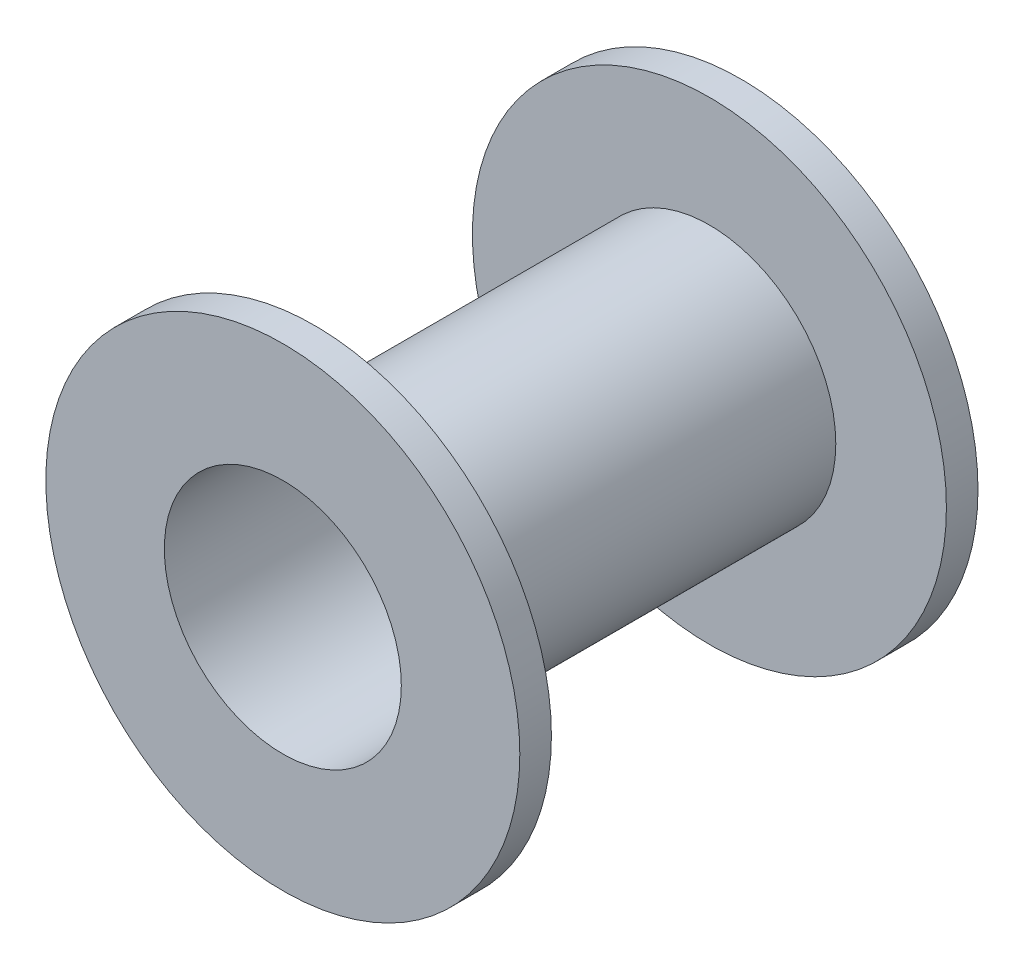
from build123d import *

# Parameters (mm, degrees)
SKETCH1_R           = 16
SKETCH1_R_2         = 15
BOSS_EXTRUDE1_DEPTH = 50
SKETCH2_R           = 30
SKETCH2_R_2         = 15
BOSS_EXTRUDE2_DEPTH = 4


with BuildPart() as part:
    # Sketch1 → Boss-Extrude1 (new body)
    with BuildSketch(Plane.XY):
        Circle(SKETCH1_R)
        Circle(SKETCH1_R_2, mode=Mode.SUBTRACT)
    extrude(amount=BOSS_EXTRUDE1_DEPTH)

    # Sketch2 → Boss-Extrude2 (add)
    with BuildSketch(Plane.XY.offset(50)):
        Circle(SKETCH2_R)
        Circle(SKETCH2_R_2, mode=Mode.SUBTRACT)
    boss_extrude2 = extrude(amount=BOSS_EXTRUDE2_DEPTH)

    # Mirror1: Boss-Extrude2 across plane
    add(boss_extrude2.mirror(Plane(origin=(0, 0, 25), x_dir=(1, 0, 0), z_dir=(0, 0, -1))))


solid = part.part
